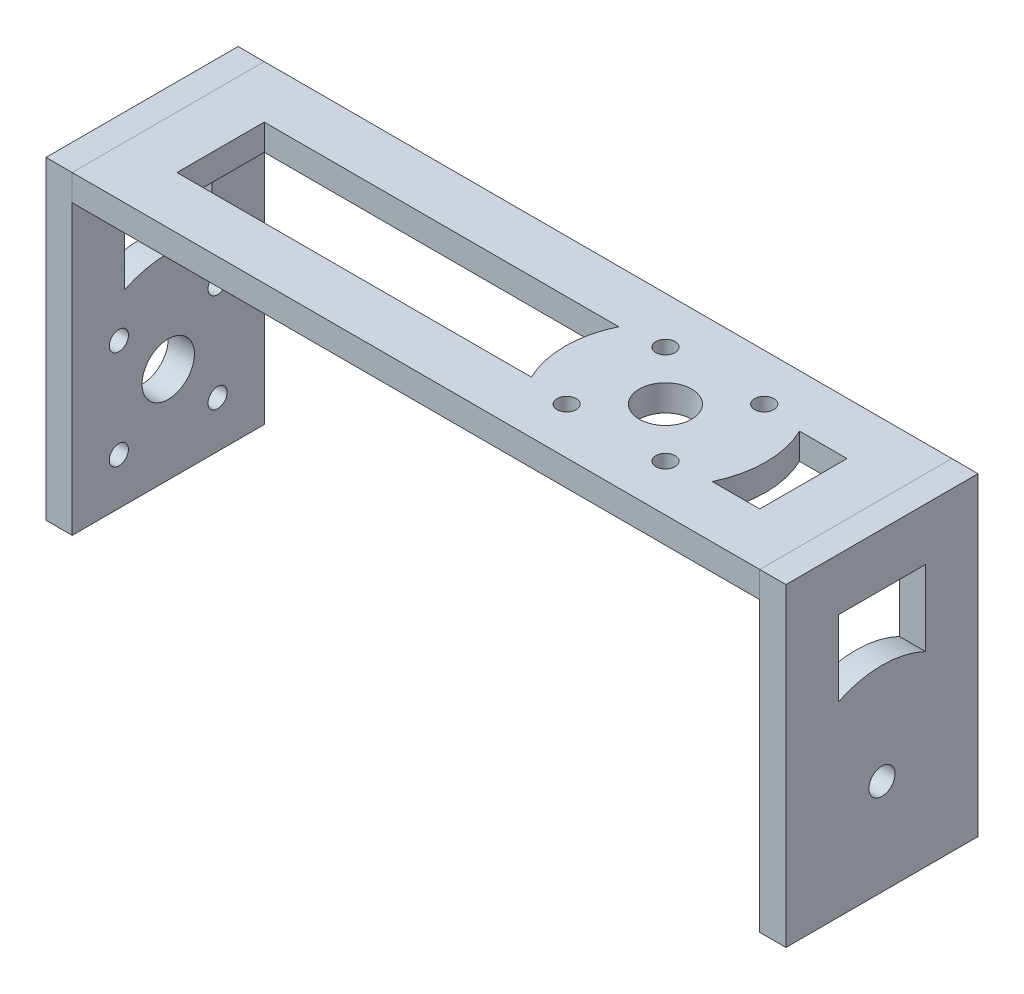
from build123d import *

# Parameters (mm, degrees)
SKETCH1_W             = 78.75
SKETCH1_H             = 22
SKETCH1_R             = 3
BOSS_EXTRUDE1_DEPTH   = 3
SKETCH1_3_W           = 3
SKETCH1_3_H           = 22
BOSS_EXTRUDE2_DEPTH   = 36
BOSS_EXTRUDE2_2_DEPTH = 36
SKETCH2_R             = 3
SKETCH2_R_2           = 1.1
CUT_EXTRUDE1_DEPTH    = 3
SKETCH3_R             = 1.5
CUT_EXTRUDE2_DEPTH    = 3
CIRPATTERN1_COUNT     = 4
SKETCH4_R             = 1.1
CUT_EXTRUDE3_DEPTH    = 3
CIRPATTERN2_COUNT     = 4
CUT_EXTRUDE4_START    = -84.75
CUT_EXTRUDE4_DEPTH    = 84.75


with BuildPart() as part:
    # Sketch1 → Boss-Extrude1 (new body)
    with BuildSketch(Plane(origin=(0, 0, 0), x_dir=(1, 0, 0), z_dir=(0, 1, 0))):
        Rectangle(SKETCH1_W, SKETCH1_H)
        with Locations(Location((17.575, 0, 0), (0, 0, 270))):
            Circle(SKETCH1_R, mode=Mode.SUBTRACT)
        with BuildLine():
            Line((33.375, 5), (27.931157589, 5))
            ThreePointArc((27.931157589, 5), (29.075, 0), (27.931157589, -5))
            Line((27.931157589, -5), (33.375, -5))
            Line((33.375, -5), (33.375, 5))
        make_face(mode=Mode.SUBTRACT)
        with BuildLine():
            Line((-33.375, 5), (-33.375, -5))
            Line((-33.375, -5), (7.218842411, -5))
            ThreePointArc((7.218842411, -5), (6.075, 0), (7.218842411, 5))
            Line((7.218842411, 5), (-33.375, 5))
        make_face(mode=Mode.SUBTRACT)
    extrude(amount=-BOSS_EXTRUDE1_DEPTH)

    # Sketch4 → Cut-Extrude3 (cut)
    with BuildSketch(Plane(origin=(0, 0, 0), x_dir=(1, 0, 0), z_dir=(0, 1, 0))):
        with Locations(Location((23.231854249, 5.656854249, 0), (0, 0, 270))):
            Circle(SKETCH4_R)
    cut_extrude3 = extrude(amount=-CUT_EXTRUDE3_DEPTH, mode=Mode.SUBTRACT)

    # CirPattern2: Cut-Extrude3 ×4 about axis
    cirpattern2_axis = Axis((17.575, 0, 0), (0, 1, 0))
    for i in range(1, CIRPATTERN2_COUNT):
        add(cut_extrude3.rotate(cirpattern2_axis, i * 360 / CIRPATTERN2_COUNT), mode=Mode.SUBTRACT)


with BuildPart() as body_2:
    # Sketch1<3> → Boss-Extrude2 (new body)
    with BuildSketch(Plane(origin=(0, 0, 0), x_dir=(1, 0, 0), z_dir=(0, 1, 0))):
        with Locations((-40.875, 0)):
            Rectangle(SKETCH1_3_W, SKETCH1_3_H)
    extrude(amount=-BOSS_EXTRUDE2_DEPTH)

    # Sketch2 → Cut-Extrude1 (cut)
    with BuildSketch(Plane.ZY.offset(42.375)):
        with Locations((0, -25)):
            Circle(SKETCH2_R)
        with Locations((5.656854249, -19.343145751)):
            Circle(SKETCH2_R_2)
    cut_extrude1 = extrude(amount=-CUT_EXTRUDE1_DEPTH, mode=Mode.SUBTRACT)

    # CirPattern1: Cut-Extrude1 ×4 about axis
    cirpattern1_axis = Axis((0, -25, 0), (1, 0, 0))
    for i in range(1, CIRPATTERN1_COUNT):
        add(cut_extrude1.rotate(cirpattern1_axis, i * 360 / CIRPATTERN1_COUNT), mode=Mode.SUBTRACT)


with BuildPart() as body_3:
    # Sketch1<3> → Boss-Extrude2 2 (new body)
    with BuildSketch(Plane(origin=(0, 0, 0), x_dir=(1, 0, 0), z_dir=(0, 1, 0))):
        with Locations((40.875, 0)):
            Rectangle(SKETCH1_3_W, SKETCH1_3_H)
    extrude(amount=-BOSS_EXTRUDE2_2_DEPTH)

    # Sketch3 → Cut-Extrude2 (cut)
    with BuildSketch(Plane(origin=(42.375, 0, 0), x_dir=(0, 0, -1), z_dir=(1, 0, 0))):
        with Locations((0, -25)):
            Circle(SKETCH3_R)
    extrude(amount=-CUT_EXTRUDE2_DEPTH, mode=Mode.SUBTRACT)


with BuildPart() as cut_extrude4_tool:
    # Sketch5 → Cut-Extrude4 (new body)
    with BuildSketch(Plane.ZY.offset(42.375).offset(CUT_EXTRUDE4_START)):
        with BuildLine():
            Line((-5, -14.643842411), (-5, -6))
            Line((-5, -6), (5, -6))
            Line((5, -6), (5, -14.643842411))
            ThreePointArc((5, -14.643842411), (0, -13.5), (-5, -14.643842411))
        make_face()
    extrude(amount=CUT_EXTRUDE4_DEPTH)


with BuildPart() as body_2_1:
    add(body_2.part)

    # Cut-Extrude4: cut by cut_extrude4_tool
    add(cut_extrude4_tool.part, mode=Mode.SUBTRACT)


with BuildPart() as body_3_1:
    add(body_3.part)

    # Cut-Extrude4: cut by cut_extrude4_tool
    add(cut_extrude4_tool.part, mode=Mode.SUBTRACT)


solid = Compound([part.part, body_2_1.part, body_3_1.part])
